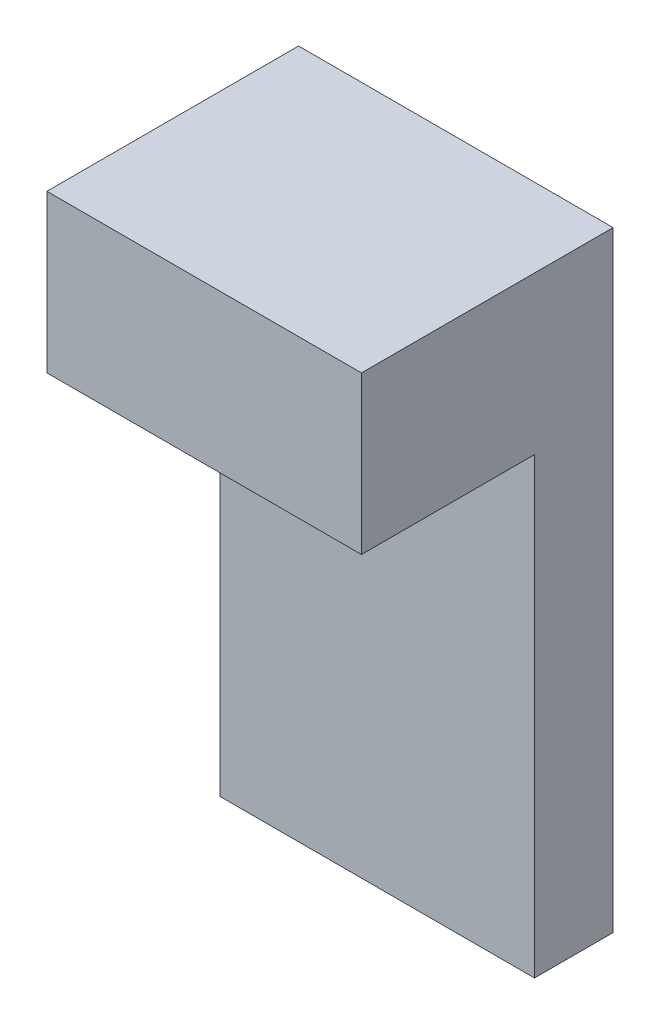
from build123d import *

# Parameters (mm, degrees)
SKETCH1_W           = 12.7
SKETCH1_H           = 49.300000012
BOSS_EXTRUDE1_DEPTH = 6.35
SKETCH3_W           = 6.35
SKETCH3_H           = 49.300000012
BOSS_EXTRUDE3_DEPTH = 12.7
SKETCH2_W           = 25.4
SKETCH2_H           = 12.7
BOSS_EXTRUDE2_DEPTH = 13.97


with BuildPart() as part:
    # Sketch1 → Boss-Extrude1 (new body)
    with BuildSketch(Plane.XY):
        with Locations((-9.26915446, 7.290553641)):
            Rectangle(SKETCH1_W, SKETCH1_H)
    extrude(amount=BOSS_EXTRUDE1_DEPTH)

    # Sketch3 → Boss-Extrude3 (add)
    with BuildSketch(Plane.ZY.offset(15.61915446)):
        with Locations((3.175, 7.290553641)):
            Rectangle(SKETCH3_W, SKETCH3_H)
    extrude(amount=BOSS_EXTRUDE3_DEPTH)

    # Sketch2 → Boss-Extrude2 (add)
    with BuildSketch(Plane.XY.offset(6.35)):
        with Locations((-15.61915446, 25.590553647)):
            Rectangle(SKETCH2_W, SKETCH2_H)
    extrude(amount=BOSS_EXTRUDE2_DEPTH)


solid = part.part
